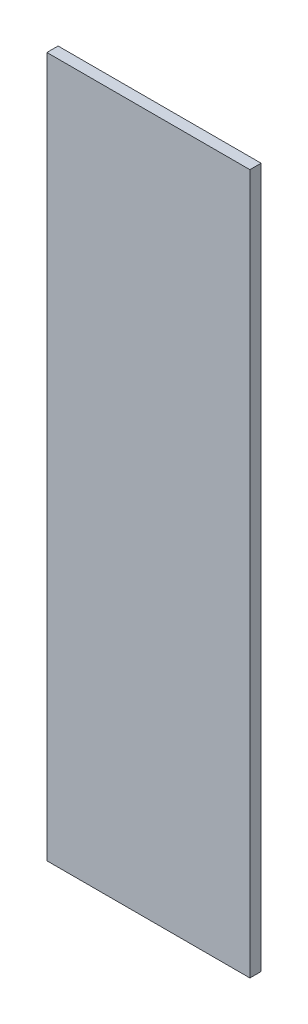
from build123d import *

# Parameters (mm, degrees)
SKETCH1_W           = 29
SKETCH1_H           = 100
BOSS_EXTRUDE1_DEPTH = 1.6


with BuildPart() as part:
    # Sketch1 → Boss-Extrude1 (new body)
    with BuildSketch(Plane.XY):
        with Locations((14.5, 50)):
            Rectangle(SKETCH1_W, SKETCH1_H)
    extrude(amount=BOSS_EXTRUDE1_DEPTH)


solid = part.part
